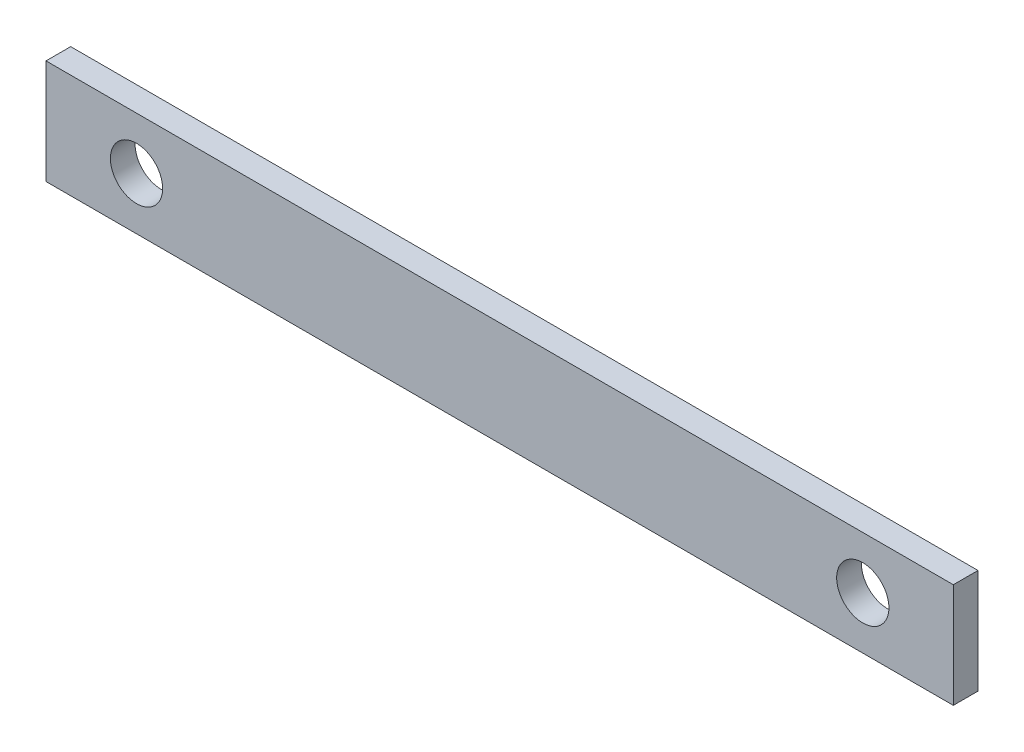
from build123d import *

# Parameters (mm, degrees)
CROQUIS1_W              = 110.26
CROQUIS1_H              = 12.7
CROQUIS1_R              = 3.175
SALIENTE_EXTRUIR1_DEPTH = 3


with BuildPart() as part:
    # Croquis1 → Saliente-Extruir1 (new body)
    with BuildSketch(Plane.XY):
        Rectangle(CROQUIS1_W, CROQUIS1_H)
        with Locations((44.13, 0)):
            Circle(CROQUIS1_R, mode=Mode.SUBTRACT)
        with Locations(Location((-44.13, 0, 0), (0, 0, 180))):
            Circle(CROQUIS1_R, mode=Mode.SUBTRACT)
    extrude(amount=SALIENTE_EXTRUIR1_DEPTH)


solid = part.part
